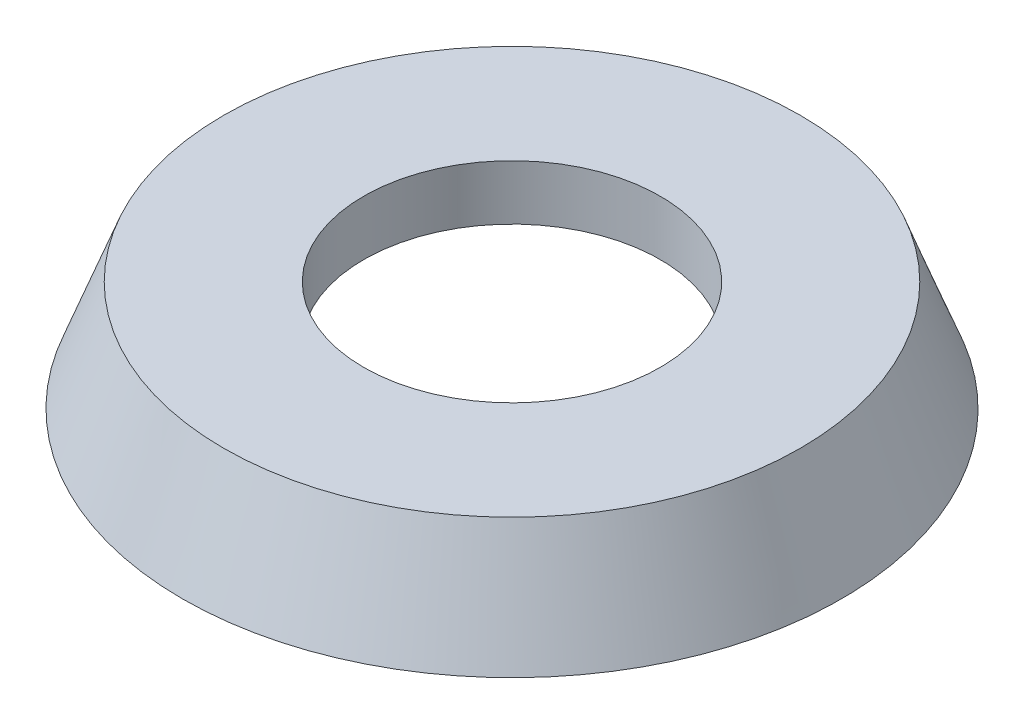
from build123d import *

# Parameters (mm, degrees)
SKETCH_1_R          = 12
SKETCH_2_R          = 10.5
SHELL_2_T           = -2
SKETCH_3_R          = 5.4
CUT_EXTRUDE_2_DEPTH = 18.435595935


with BuildPart() as part:
    # 草图1 → 放样1 section 0
    with BuildSketch(Plane(origin=(0, 0, 0), x_dir=(1, 0, 0), z_dir=(0, 1, 0))):
        Circle(SKETCH_1_R)
    # 草图2 → 放样1 section 1
    with BuildSketch(Plane(origin=(0, 4, 0), x_dir=(1, 0, 0), z_dir=(0, 1, 0))):
        Circle(SKETCH_2_R)
    loft()

    # 抽壳2
    shell_2_openings = [part.faces().sort_by_distance(p)[0] for p in [
        (0, 0, 0),
    ]]
    offset(amount=SHELL_2_T, openings=shell_2_openings, kind=Kind.INTERSECTION)

    # 草图3 → 切除-拉伸2 (cut, through all)
    with BuildSketch(Plane(origin=(0, 4, 0), x_dir=(1, 0, 0), z_dir=(0, 1, 0))):
        with Locations(Location((0, 0, 0), (0, 0, 270))):
            Circle(SKETCH_3_R)
    extrude(amount=-CUT_EXTRUDE_2_DEPTH, mode=Mode.SUBTRACT)


solid = part.part
